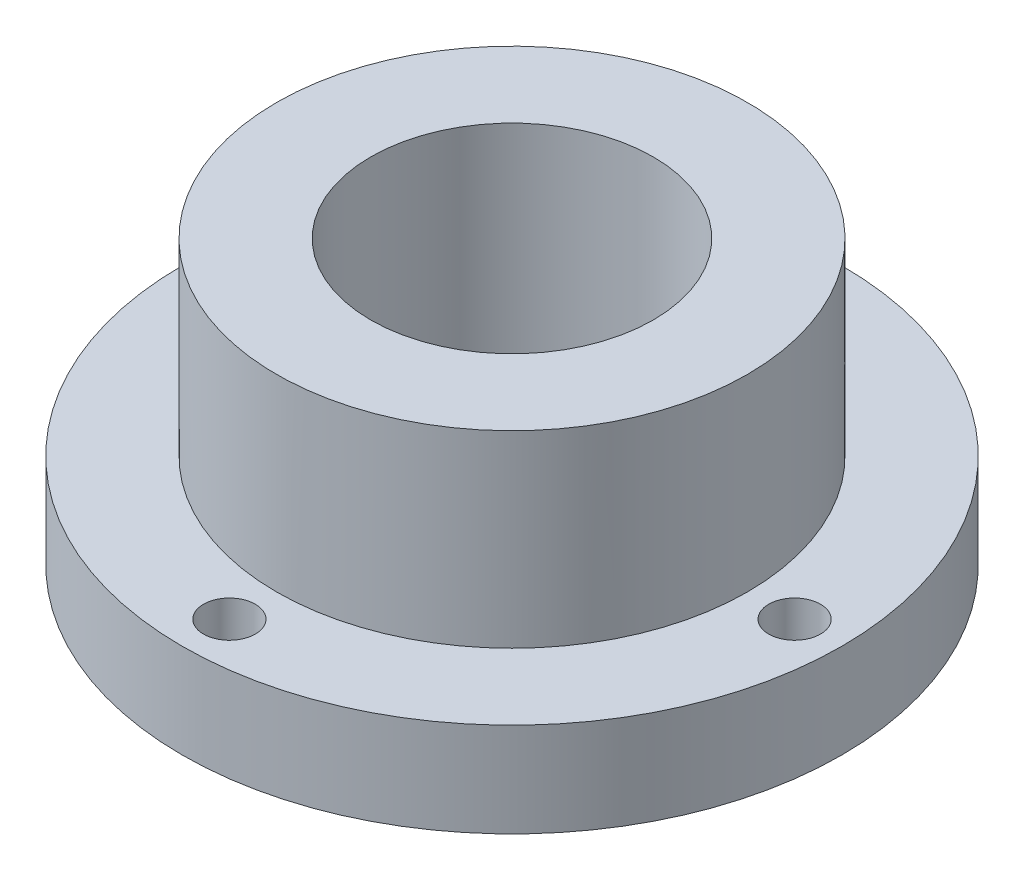
from build123d import *

# Parameters (mm, degrees)
SKETCH_1_R          = 35
EXTRUDE_1_DEPTH     = 10
SKETCH_4_R          = 25
SKETCH_4_R_2        = 15
EXTRUDE_1_2_DEPTH   = 30
HOLE_WIZARD_1_D     = 5.5
SKETCH_7_R          = 15
CUT_EXTRUDE_1_DEPTH = 54.38539126


with BuildPart() as part:
    # 草图1 → Extrude 1 (new body)
    with BuildSketch(Plane(origin=(0, 0, 0), x_dir=(1, 0, 0), z_dir=(0, 1, 0))):
        with Locations(Location((0, 0, 0), (0, 0, 270))):
            Circle(SKETCH_1_R)
    extrude(amount=EXTRUDE_1_DEPTH)

    # 草图4 → Extrude 1 2 (add)
    with BuildSketch(Plane.XZ):
        Circle(SKETCH_4_R)
        Circle(SKETCH_4_R_2, mode=Mode.SUBTRACT)
    extrude(amount=-EXTRUDE_1_2_DEPTH)

    # 孔1 (through all)
    with Locations(Plane(origin=(0, 10, 0), x_dir=(1, 0, 0), z_dir=(0, 1, 0))):
        with Locations((0, 30), (30, 0), (0, -30), (-30, 0)):
            Hole(HOLE_WIZARD_1_D / 2)

    # 草图7 → 切除-拉伸1 (cut, through all)
    with BuildSketch(Plane(origin=(0, 10, 0), x_dir=(1, 0, 0), z_dir=(0, 1, 0))):
        with Locations(Location((0, 0, 0), (0, 0, 90))):
            Circle(SKETCH_7_R)
    extrude(amount=-CUT_EXTRUDE_1_DEPTH, mode=Mode.SUBTRACT)


solid = part.part
